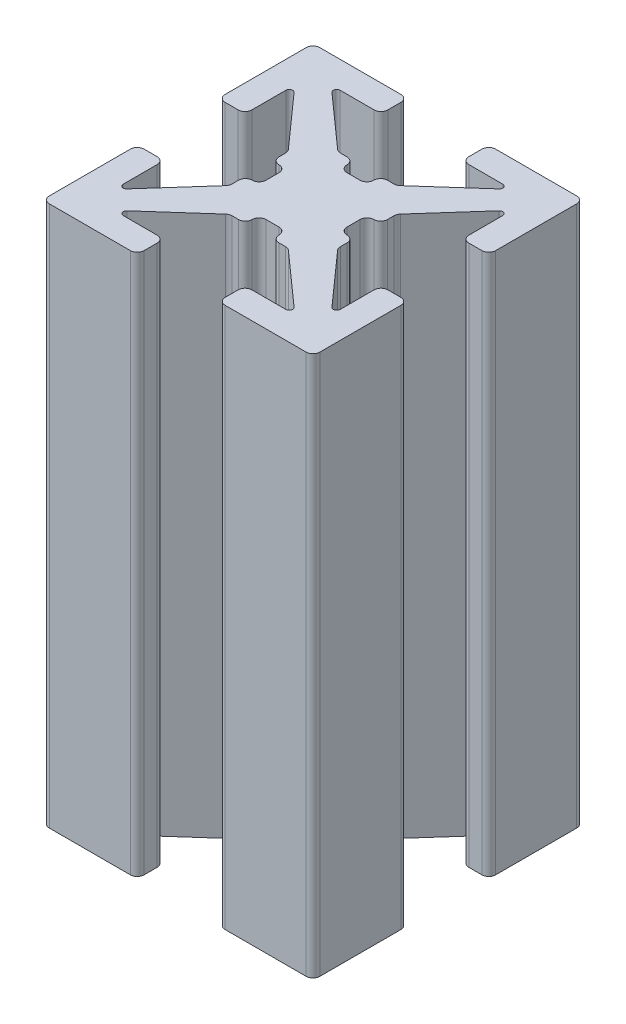
from build123d import *

# Parameters (mm, degrees)
BOSS_EXTRUDE1_DEPTH = 20.0000108


with BuildPart() as part:
    # Sketch1 → Boss-Extrude1 (new body)
    with BuildSketch(Plane(origin=(0, 0, 0), x_dir=(1, 0, 0), z_dir=(0, 1, 0))):
        with BuildLine():
            Line((-1.159549536, 2.070936998), (-3.090908521, 3.791368499))
            ThreePointArc((-3.090908521, 3.791368499), (-3.125119474, 3.931396235), (-3.006433754, 4.0132))
            Line((-3.006433754, 4.0132), (-1.7526, 4.0132))
            ThreePointArc((-1.7526, 4.0132), (-1.572994878, 4.087594878), (-1.4986, 4.2672))
            Line((-1.4986, 4.2672), (-1.4986, 4.7498))
            ThreePointArc((-1.4986, 4.7498), (-1.572994878, 4.929405122), (-1.7526, 5.0038))
            Line((-1.7526, 5.0038), (-4.7498, 5.0038))
            ThreePointArc((-4.7498, 5.0038), (-4.929405122, 4.929405122), (-5.0038, 4.7498))
            Line((-5.0038, 4.7498), (-5.0038, 1.7526))
            ThreePointArc((-5.0038, 1.7526), (-4.929405122, 1.572994878), (-4.7498, 1.4986))
            Line((-4.7498, 1.4986), (-4.2672, 1.4986))
            ThreePointArc((-4.2672, 1.4986), (-4.087594878, 1.572994878), (-4.0132, 1.7526))
            Line((-4.0132, 1.7526), (-4.0132, 3.006433754))
            ThreePointArc((-4.0132, 3.006433754), (-3.931396235, 3.125119474), (-3.791368499, 3.090908521))
            Line((-3.791368499, 3.090908521), (-2.070936998, 1.159549536))
            ThreePointArc((-2.070936998, 1.159549536), (-2.023228558, 1.08099247), (-2.0066, 0.9906))
            Line((-2.0066, 0.9906), (-2.0066, 0.7493))
            ThreePointArc((-2.0066, 0.7493), (-1.932205122, 0.569694878), (-1.7526, 0.4953))
            ThreePointArc((-1.7526, 0.4953), (-1.572994878, 0.420905122), (-1.4986, 0.2413))
            Line((-1.4986, 0.2413), (-1.4986, -0.2413))
            ThreePointArc((-1.4986, -0.2413), (-1.572994878, -0.420905122), (-1.7526, -0.4953))
            ThreePointArc((-1.7526, -0.4953), (-1.932205122, -0.569694878), (-2.0066, -0.7493))
            Line((-2.0066, -0.7493), (-2.0066, -0.9906))
            ThreePointArc((-2.0066, -0.9906), (-2.023228558, -1.08099247), (-2.070936998, -1.159549536))
            Line((-2.070936998, -1.159549536), (-3.791368499, -3.090908521))
            ThreePointArc((-3.791368499, -3.090908521), (-3.931396235, -3.125119474), (-4.0132, -3.006433754))
            Line((-4.0132, -3.006433754), (-4.0132, -1.7526))
            ThreePointArc((-4.0132, -1.7526), (-4.087594878, -1.572994878), (-4.2672, -1.4986))
            Line((-4.2672, -1.4986), (-4.7498, -1.4986))
            ThreePointArc((-4.7498, -1.4986), (-4.929405122, -1.572994878), (-5.0038, -1.7526))
            Line((-5.0038, -1.7526), (-5.0038, -4.7498))
            ThreePointArc((-5.0038, -4.7498), (-4.929405122, -4.929405122), (-4.7498, -5.0038))
            Line((-4.7498, -5.0038), (-1.7526, -5.0038))
            ThreePointArc((-1.7526, -5.0038), (-1.572994878, -4.929405122), (-1.4986, -4.7498))
            Line((-1.4986, -4.7498), (-1.4986, -4.2672))
            ThreePointArc((-1.4986, -4.2672), (-1.572994878, -4.087594878), (-1.7526, -4.0132))
            Line((-1.7526, -4.0132), (-3.006433754, -4.0132))
            ThreePointArc((-3.006433754, -4.0132), (-3.125119474, -3.931396235), (-3.090908521, -3.791368499))
            Line((-3.090908521, -3.791368499), (-1.159549536, -2.070936998))
            ThreePointArc((-1.159549536, -2.070936998), (-1.08099247, -2.023228558), (-0.9906, -2.0066))
            Line((-0.9906, -2.0066), (-0.7493, -2.0066))
            ThreePointArc((-0.7493, -2.0066), (-0.569694878, -1.932205122), (-0.4953, -1.7526))
            ThreePointArc((-0.4953, -1.7526), (-0.420905122, -1.572994878), (-0.2413, -1.4986))
            Line((-0.2413, -1.4986), (0.2413, -1.4986))
            ThreePointArc((0.2413, -1.4986), (0.420905122, -1.572994878), (0.4953, -1.7526))
            ThreePointArc((0.4953, -1.7526), (0.569694878, -1.932205122), (0.7493, -2.0066))
            Line((0.7493, -2.0066), (0.9906, -2.0066))
            ThreePointArc((0.9906, -2.0066), (1.08099247, -2.023228558), (1.159549536, -2.070936998))
            Line((1.159549536, -2.070936998), (3.090908521, -3.791368499))
            ThreePointArc((3.090908521, -3.791368499), (3.125119474, -3.931396235), (3.006433754, -4.0132))
            Line((3.006433754, -4.0132), (1.7526, -4.0132))
            ThreePointArc((1.7526, -4.0132), (1.572994878, -4.087594878), (1.4986, -4.2672))
            Line((1.4986, -4.2672), (1.4986, -4.7498))
            ThreePointArc((1.4986, -4.7498), (1.572994878, -4.929405122), (1.7526, -5.0038))
            Line((1.7526, -5.0038), (4.7498, -5.0038))
            ThreePointArc((4.7498, -5.0038), (4.929405122, -4.929405122), (5.0038, -4.7498))
            Line((5.0038, -4.7498), (5.0038, -1.7526))
            ThreePointArc((5.0038, -1.7526), (4.929405122, -1.572994878), (4.7498, -1.4986))
            Line((4.7498, -1.4986), (4.2672, -1.4986))
            ThreePointArc((4.2672, -1.4986), (4.087594878, -1.572994878), (4.0132, -1.7526))
            Line((4.0132, -1.7526), (4.0132, -3.006433754))
            ThreePointArc((4.0132, -3.006433754), (3.931396235, -3.125119474), (3.791368499, -3.090908521))
            Line((3.791368499, -3.090908521), (2.070936998, -1.159549536))
            ThreePointArc((2.070936998, -1.159549536), (2.023228558, -1.08099247), (2.0066, -0.9906))
            Line((2.0066, -0.9906), (2.0066, -0.7493))
            ThreePointArc((2.0066, -0.7493), (1.932205122, -0.569694878), (1.7526, -0.4953))
            ThreePointArc((1.7526, -0.4953), (1.572994878, -0.420905122), (1.4986, -0.2413))
            Line((1.4986, -0.2413), (1.4986, 0.2413))
            ThreePointArc((1.4986, 0.2413), (1.572994878, 0.420905122), (1.7526, 0.4953))
            ThreePointArc((1.7526, 0.4953), (1.932205122, 0.569694878), (2.0066, 0.7493))
            Line((2.0066, 0.7493), (2.0066, 0.9906))
            ThreePointArc((2.0066, 0.9906), (2.023228558, 1.08099247), (2.070936998, 1.159549536))
            Line((2.070936998, 1.159549536), (3.791368499, 3.090908521))
            ThreePointArc((3.791368499, 3.090908521), (3.931396235, 3.125119474), (4.0132, 3.006433754))
            Line((4.0132, 3.006433754), (4.0132, 1.7526))
            ThreePointArc((4.0132, 1.7526), (4.087594878, 1.572994878), (4.2672, 1.4986))
            Line((4.2672, 1.4986), (4.7498, 1.4986))
            ThreePointArc((4.7498, 1.4986), (4.929405122, 1.572994878), (5.0038, 1.7526))
            Line((5.0038, 1.7526), (5.0038, 4.7498))
            ThreePointArc((5.0038, 4.7498), (4.929405122, 4.929405122), (4.7498, 5.0038))
            Line((4.7498, 5.0038), (1.7526, 5.0038))
            ThreePointArc((1.7526, 5.0038), (1.572994878, 4.929405122), (1.4986, 4.7498))
            Line((1.4986, 4.7498), (1.4986, 4.2672))
            ThreePointArc((1.4986, 4.2672), (1.572994878, 4.087594878), (1.7526, 4.0132))
            Line((1.7526, 4.0132), (3.006433754, 4.0132))
            ThreePointArc((3.006433754, 4.0132), (3.125119474, 3.931396235), (3.090908521, 3.791368499))
            Line((3.090908521, 3.791368499), (1.159549536, 2.070936998))
            ThreePointArc((1.159549536, 2.070936998), (1.08099247, 2.023228558), (0.9906, 2.0066))
            Line((0.9906, 2.0066), (0.7493, 2.0066))
            ThreePointArc((0.7493, 2.0066), (0.569694878, 1.932205122), (0.4953, 1.7526))
            ThreePointArc((0.4953, 1.7526), (0.420905122, 1.572994878), (0.2413, 1.4986))
            Line((0.2413, 1.4986), (-0.2413, 1.4986))
            ThreePointArc((-0.2413, 1.4986), (-0.420905122, 1.572994878), (-0.4953, 1.7526))
            ThreePointArc((-0.4953, 1.7526), (-0.569694878, 1.932205122), (-0.7493, 2.0066))
            Line((-0.7493, 2.0066), (-0.9906, 2.0066))
            ThreePointArc((-0.9906, 2.0066), (-1.08099247, 2.023228558), (-1.159549536, 2.070936998))
        make_face()
    extrude(amount=BOSS_EXTRUDE1_DEPTH)


solid = part.part
